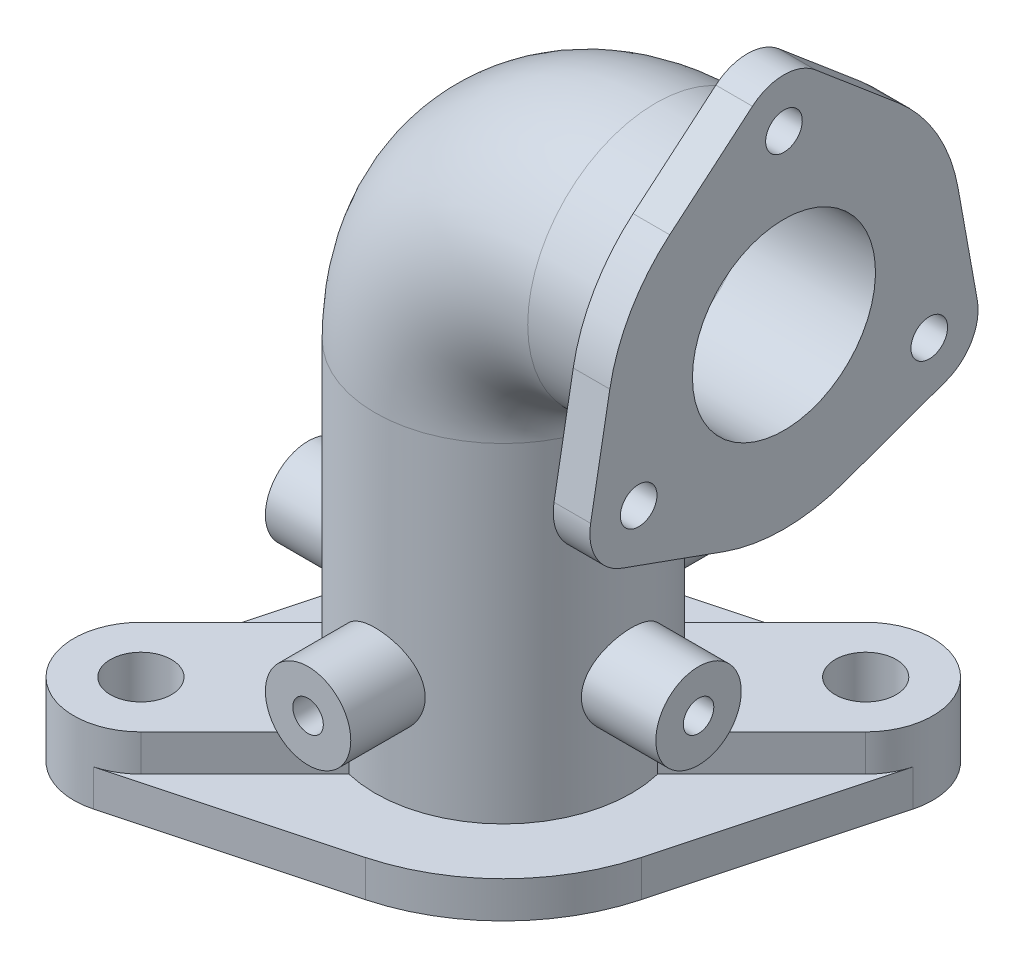
from build123d import *

# Parameters (mm, degrees)
SKETCH2_R                = 21
SKETCH2_R_2              = 15
SKETCH4_R                = 3
SKETCH4_R_2              = 15
BOSS_EXTRUDE1_DEPTH      = 6
BOSS_EXTRUDE2_START      = -6
SKETCH5_R                = 15
BOSS_EXTRUDE2_DEPTH      = 6
BOSS_EXTRUDE3_START      = 6
BOSS_EXTRUDE3_DEPTH      = 6
HOLE1_D                  = 10
BOSS_EXTRUDE5_REACH      = 150.059
BOSS_EXTRUDE5_END_RADIUS = 21
SKETCH10_R               = 7
CIRPATTERN1_COUNT        = 4
HOLE2_REACH              = 150.059
HOLE2_BORE_R             = 2.5
CIRPATTERN2_COUNT        = 4


with BuildPart() as part:
    # Sweep1: sweep along a path in Sketch1
    with BuildLine(Plane.XY) as sweep1_path:
        Line((0, 0), (0, 60))
        ThreePointArc((0, 60), (7.32233047, 77.67766953), (25, 85))
        Line((25, 85), (46, 85))
    # Sketch2 → Sweep1 (sweep)
    with BuildSketch(Plane(origin=(0, 0, 0), x_dir=(1, 0, 0), z_dir=(0, 1, 0))):
        Circle(SKETCH2_R)
        Circle(SKETCH2_R_2, mode=Mode.SUBTRACT)
    sweep(path=sweep1_path.line)

    # Sketch4 → Boss-Extrude1 (add)
    with BuildSketch(Plane(origin=(46, 0, 0), x_dir=(0, 0, -1), z_dir=(1, 0, 0))):
        with BuildLine():
            Line((5.165172627, 118.609090909), (18.723750772, 107.145454545))
            ThreePointArc((18.723750772, 107.145454545), (25.11473671, 99.5), (28.540401601, 90.14251655))
            Line((28.540401601, 90.14251655), (31.688912839, 72.668625255))
            ThreePointArc((31.688912839, 72.668625255), (30.743901834, 67.25), (26.523740212, 63.722283836))
            Line((26.523740212, 63.722283836), (9.816650829, 57.712028905))
            ThreePointArc((9.816650829, 57.712028905), (0, 56), (-9.816650829, 57.712028905))
            Line((-9.816650829, 57.712028905), (-26.523740212, 63.722283836))
            ThreePointArc((-26.523740212, 63.722283836), (-30.743901834, 67.25), (-31.688912839, 72.668625255))
            Line((-31.688912839, 72.668625255), (-28.540401601, 90.14251655))
            ThreePointArc((-28.540401601, 90.14251655), (-25.11473671, 99.5), (-18.723750772, 107.145454545))
            Line((-18.723750772, 107.145454545), (-5.165172627, 118.609090909))
            ThreePointArc((-5.165172627, 118.609090909), (0, 120.5), (5.165172627, 118.609090909))
        make_face()
        with Locations(Location((0, 112.5, 0), (0, 0, 90))):
            Circle(SKETCH4_R, mode=Mode.SUBTRACT)
        with Locations(Location((23.815698604, 71.25, 0), (0, 0, 90))):
            Circle(SKETCH4_R, mode=Mode.SUBTRACT)
        with Locations(Location((-23.815698604, 71.25, 0), (0, 0, 90))):
            Circle(SKETCH4_R, mode=Mode.SUBTRACT)
        with Locations(Location((0, 85, 0), (0, 0, 90))):
            Circle(SKETCH4_R_2, mode=Mode.SUBTRACT)
    extrude(amount=-BOSS_EXTRUDE1_DEPTH)

    # Sketch5 → Boss-Extrude2 (add)
    with BuildSketch(Plane.XZ.offset(BOSS_EXTRUDE2_START)):
        with BuildLine():
            Line((-40.323668899, 26.851475314), (-30.909626441, -8.282209443))
            ThreePointArc((-30.909626441, -8.282209443), (-22.627416998, -22.627416998), (-8.282209443, -30.909626441))
            Line((-8.282209443, -30.909626441), (26.851475314, -40.323668899))
            ThreePointArc((26.851475314, -40.323668899), (37.476659403, -37.476659403), (40.323668899, -26.851475314))
            Line((40.323668899, -26.851475314), (30.909626441, 8.282209443))
            ThreePointArc((30.909626441, 8.282209443), (22.627416998, 22.627416998), (8.282209443, 30.909626441))
            Line((8.282209443, 30.909626441), (-26.851475314, 40.323668899))
            ThreePointArc((-26.851475314, 40.323668899), (-37.476659403, 37.476659403), (-40.323668899, 26.851475314))
        make_face()
        with Locations(Location((0, 0, 0), (0, 0, 90))):
            Circle(SKETCH5_R, mode=Mode.SUBTRACT)
    extrude(amount=BOSS_EXTRUDE2_DEPTH)

    # Sketch7 → Boss-Extrude3 (add)
    with BuildSketch(Plane(origin=(0, 6, 0), x_dir=(1, 0, 0), z_dir=(0, 1, 0)).offset(BOSS_EXTRUDE3_START)):
        with BuildLine():
            Line((-37.476659403, -21.920310217), (-20.427285234, -4.870936048))
            ThreePointArc((-20.427285234, -4.870936048), (-14.849242405, -14.849242405), (-4.870936048, -20.427285234))
            Line((-4.870936048, -20.427285234), (-21.920310217, -37.476659403))
            ThreePointArc((-21.920310217, -37.476659403), (-37.476659403, -37.476659403), (-37.476659403, -21.920310217))
        make_face()
        with BuildLine():
            Line((20.427285234, 4.870936048), (37.476659403, 21.920310217))
            ThreePointArc((37.476659403, 21.920310217), (37.476659403, 37.476659403), (21.920310217, 37.476659403))
            Line((21.920310217, 37.476659403), (4.870936048, 20.427285234))
            ThreePointArc((4.870936048, 20.427285234), (14.849242405, 14.849242405), (20.427285234, 4.870936048))
        make_face()
    extrude(amount=-BOSS_EXTRUDE3_DEPTH)

    # Hole1 (through all)
    with Locations(Plane(origin=(0, 12, 0), x_dir=(1, 0, 0), z_dir=(0, 1, 0))):
        with Locations((-29.69848481, -29.69848481), (29.69848481, 29.69848481)):
            Hole(HOLE1_D / 2)

    # Boss-Extrude5: up to this cylinder (the profile starts outside it)
    boss_extrude5_end = Plane(origin=(0, 22.5, 0), z_dir=(0, 1, 0)) * Cylinder(BOSS_EXTRUDE5_END_RADIUS, 343.118, mode=Mode.PRIVATE)
    # Sketch10 → Boss-Extrude5 (add, up to the surface)
    with BuildSketch(Plane.XY.offset(32), mode=Mode.PRIVATE) as boss_extrude5_sk1:
        with Locations((0, 22.5)):
            Circle(SKETCH10_R)
    boss_extrude5_tool1 = extrude(boss_extrude5_sk1.sketch, amount=-BOSS_EXTRUDE5_REACH, mode=Mode.PRIVATE) - boss_extrude5_end
    boss_extrude5 = boss_extrude5_tool1.solids().sort_by_distance((0, 22.5, 32))[0]
    add(boss_extrude5)

    # CirPattern1: Boss-Extrude5 ×4 about axis
    cirpattern1_axis = Axis((0, 0, 0), (0, 1, 0))
    for i in range(1, CIRPATTERN1_COUNT):
        add(boss_extrude5.rotate(cirpattern1_axis, i * 360 / CIRPATTERN1_COUNT))

    # Hole2 bore → Hole2 (cut, up to next)
    with BuildSketch(Plane.XY.offset(32), mode=Mode.PRIVATE) as hole2_sk1:
        with Locations((0, 22.5)):
            Circle(HOLE2_BORE_R)
    hole2_tool1 = extrude(hole2_sk1.sketch, amount=-HOLE2_REACH, mode=Mode.PRIVATE) & part.part
    hole2 = hole2_tool1.solids().sort_by_distance((0, 22.5, 32))[0]
    add(hole2, mode=Mode.SUBTRACT)

    # CirPattern2: Hole2 ×4 about axis
    cirpattern2_axis = Axis((0, 0, 0), (0, 1, 0))
    for i in range(1, CIRPATTERN2_COUNT):
        add(hole2.rotate(cirpattern2_axis, i * 360 / CIRPATTERN2_COUNT), mode=Mode.SUBTRACT)


solid = part.part
